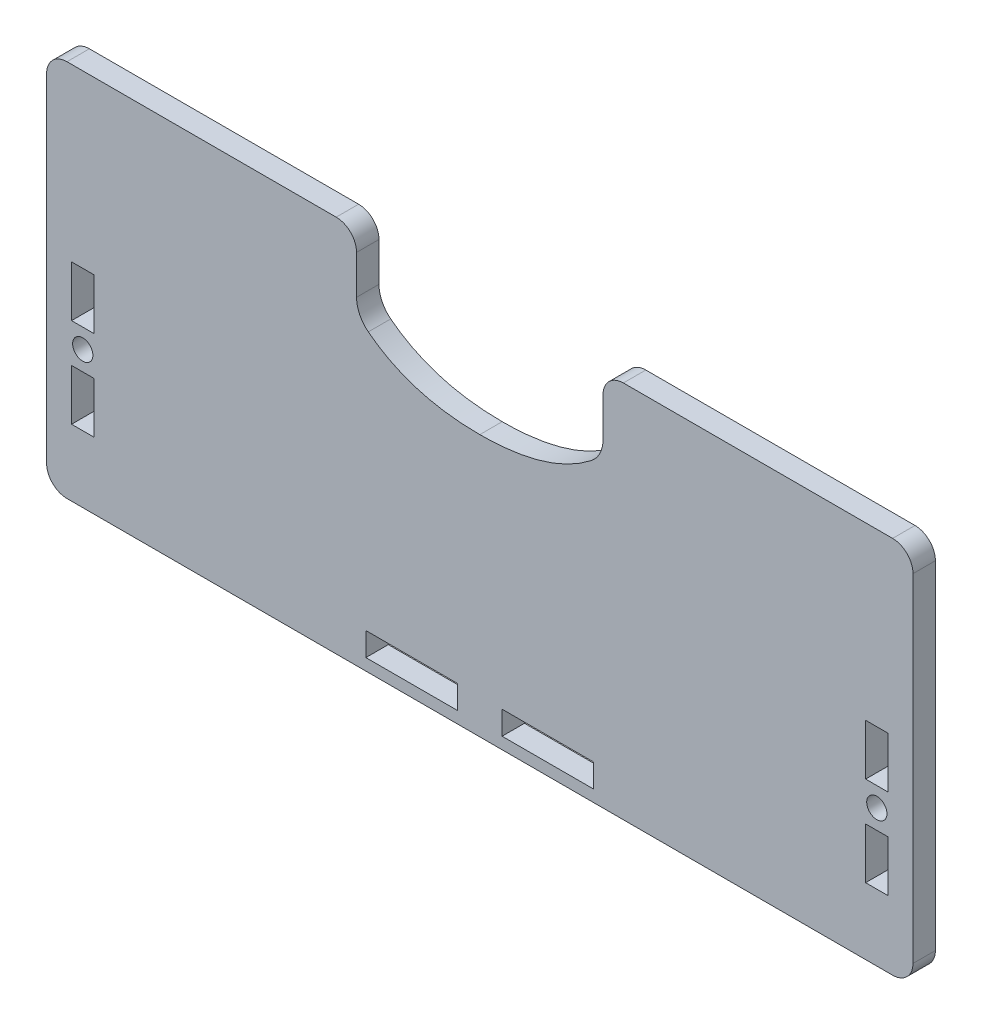
from build123d import *

# Parameters (mm, degrees)
BOSS_EXTRUDE1_DEPTH = 5.588
FILLET1_R           = 5.08
FILLET3_R           = 7.62
SKETCH3_R           = 2.5273
SKETCH3_W           = 5.588
SKETCH3_H           = 12.7
CUT_EXTRUDE2_DEPTH  = 138.960432195
BOSS_EXTRUDE3_DEPTH = 5.588


with BuildPart() as part:
    # Sketch1 → Boss-Extrude1 (new body)
    with BuildSketch(Plane.XY):
        with BuildLine():
            Line((-108.048552, 85.600032), (-30.737556, 85.600032))
            Line((-30.737556, 85.600032), (-30.737556, 67.394105789))
            add(Edge.make_bspline(
                [(-30.737556, 67.394105789), (-19.663465212, 56.532474897), (0, 56.532474897)],
                knots=[0, 0, 0, 1, 1, 1], degree=2))
            add(Edge.make_bspline(
                [(30.737556, 67.394105789), (19.663465212, 56.532474897), (0, 56.532474897)],
                knots=[0, 0, 0, 1, 1, 1], degree=2))
            Line((30.737556, 67.394105789), (30.737556, 85.600032))
            Line((30.737556, 85.600032), (108.048552, 85.600032))
            Line((108.048552, 85.600032), (108.048552, 0))
            Line((108.048552, 0), (-108.048552, 0))
            Line((-108.048552, 0), (-108.048552, 85.600032))
        make_face()
    extrude(amount=BOSS_EXTRUDE1_DEPTH)

    # Fillet1
    fillet1_edges = [part.edges().sort_by_distance(p)[0] for p in [
        (30.737556, 85.600032, 2.794),
        (108.048552, 85.600032, 2.794),
        (108.048552, 0, 2.794),
        (-108.048552, 0, 2.794),
        (-108.048552, 85.600032, 2.794),
        (-30.737556, 85.600032, 2.794),
    ]]
    fillet(fillet1_edges, radius=FILLET1_R)

    # Fillet3
    fillet3_edges = [part.edges().sort_by_distance(p)[0] for p in [
        (30.737556, 67.394105789, 2.794),
        (-30.737556, 67.394105789, 2.794),
    ]]
    fillet(fillet3_edges, radius=FILLET3_R)

    # Sketch3 → Cut-Extrude2 (cut, through all)
    with BuildSketch(Plane.XY):
        with Locations((-99.031552, 25.4)):
            Circle(SKETCH3_R)
        with Locations((99.031552, 25.4)):
            Circle(SKETCH3_R)
        with Locations((-99.031552, 14.208252)):
            Rectangle(SKETCH3_W, SKETCH3_H)
        with Locations((99.031552, 14.208252)):
            Rectangle(SKETCH3_W, SKETCH3_H)
        with Locations((-99.031552, 36.591748)):
            Rectangle(SKETCH3_W, SKETCH3_H)
        with Locations((99.031552, 36.591748)):
            Rectangle(SKETCH3_W, SKETCH3_H)
    extrude(amount=CUT_EXTRUDE2_DEPTH, mode=Mode.SUBTRACT)

    # Sketch5 → Boss-Extrude3 (add)
    with BuildSketch(Plane.XY.offset(5.588)):
        with BuildLine():
            ThreePointArc((-102.968552, 0), (-106.560654448, 1.487897552), (-108.048552, 5.08))
            Line((-108.048552, 5.08), (-108.048552, -3.683))
            ThreePointArc((-108.048552, -3.683), (-106.560654448, -7.275102448), (-102.968552, -8.763))
            Line((-102.968552, -8.763), (102.968552, -8.763))
            ThreePointArc((102.968552, -8.763), (106.560654448, -7.275102448), (108.048552, -3.683))
            Line((108.048552, -3.683), (108.048552, 5.08))
            ThreePointArc((108.048552, 5.08), (106.560654448, 1.487897552), (102.968552, 0))
            Line((102.968552, 0), (28.41625, 0))
            Line((28.41625, 0), (28.41625, -5.842))
            Line((28.41625, -5.842), (5.55625, -5.842))
            Line((5.55625, -5.842), (5.55625, 0))
            Line((5.55625, 0), (-5.55625, 0))
            Line((-5.55625, 0), (-5.55625, -5.842))
            Line((-5.55625, -5.842), (-28.41625, -5.842))
            Line((-28.41625, -5.842), (-28.41625, 0))
            Line((-28.41625, 0), (-102.968552, 0))
        make_face()
    extrude(amount=-BOSS_EXTRUDE3_DEPTH)


solid = part.part
